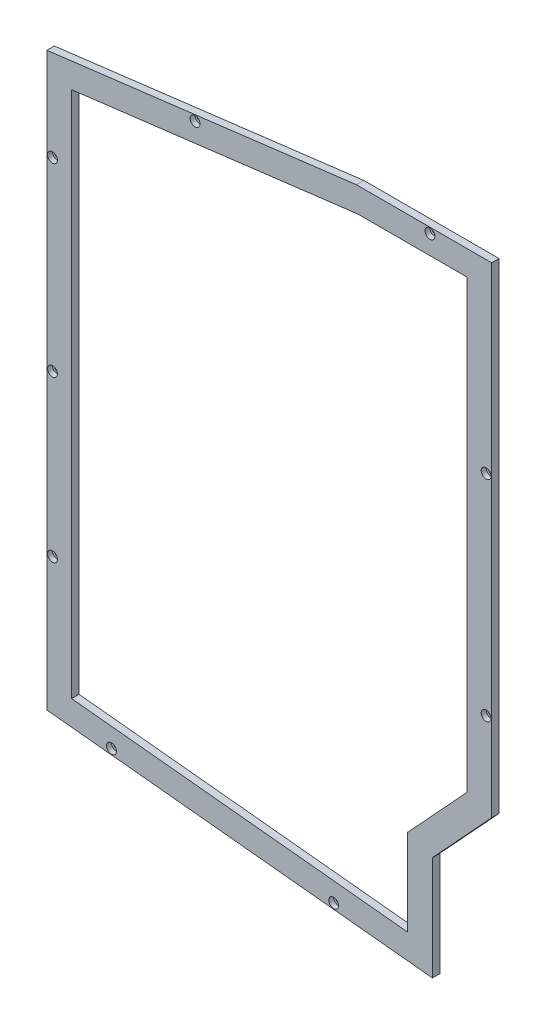
from build123d import *

# Parameters (mm, degrees)
BOSS_EXTRU_1_DEPTH                              = 6
BOSS_EXTRU_2_DEPTH                              = 6
CHAMBRAGE_POUR_VIS_T_TE_CYLINDRIQUE_D           = 4.3
CHAMBRAGE_POUR_VIS_T_TE_CYLINDRIQUE_DEPTH       = 14
CHAMBRAGE_POUR_VIS_T_TE_CYLINDRIQUE_CBORE_D     = 8
CHAMBRAGE_POUR_VIS_T_TE_CYLINDRIQUE_CBORE_DEPTH = 4
CHAMBRAGE_POUR_VIS_T_TE_CYLINDRIQUE_TIP         = 1.291850331


with BuildPart() as part:
    # Esquisse1 → Boss.-Extru.1 (new body)
    with BuildSketch(Plane.XY):
        Polygon((-377.3, 239.035929653), (-377.3, 20.870792038), (-65, -10.964070347), (-65, 73.48114549), (-17, 125.48114549), (-17, 225.48114549), (-37, 239.035929653), (-37, 133.300822179), (-85, 81.300822179), (-85, 11.178308202), (-357.3, 38.93569862), (-357.3, 225.48114549), align=None)
    extrude(amount=BOSS_EXTRU_1_DEPTH)

    # Esquisse3 → Boss.-Extru.2 (add)
    with BuildSketch(Plane.XY):
        Polygon((-17, 225.48114549), (-17, 514.843253), (-126.55504147, 514.843253), (-377.3, 483.797653512), (-377.3, 239.035929653), (-357.3, 225.48114549), (-357.3, 466.12120793), (-125.321615981, 494.843253), (-37, 494.843253), (-37, 239.035929653), align=None)
    extrude(amount=BOSS_EXTRU_2_DEPTH)

    # Chambrage pour vis à tête cylindrique à 6 pans creux (ou vis CHC) M41
    with Locations(Plane.XY.offset(6)):
        with Locations((-145, 1.714193165), (-325, 20.062817018), (-372.8, 130.870792038), (-372.8, 260.870792038), (-372.8, 410.870792038), (-257.3, 494.120907239), (-67, 510.343253), (-21.5, 194.843253), (-21.5, 364.843253)):
            CounterBoreHole(CHAMBRAGE_POUR_VIS_T_TE_CYLINDRIQUE_D / 2, CHAMBRAGE_POUR_VIS_T_TE_CYLINDRIQUE_CBORE_D / 2, CHAMBRAGE_POUR_VIS_T_TE_CYLINDRIQUE_CBORE_DEPTH, depth=CHAMBRAGE_POUR_VIS_T_TE_CYLINDRIQUE_DEPTH)
            with Locations((0, 0, -(CHAMBRAGE_POUR_VIS_T_TE_CYLINDRIQUE_DEPTH + CHAMBRAGE_POUR_VIS_T_TE_CYLINDRIQUE_TIP / 2))):  # 118° drill point
                Cone(0, CHAMBRAGE_POUR_VIS_T_TE_CYLINDRIQUE_D / 2, CHAMBRAGE_POUR_VIS_T_TE_CYLINDRIQUE_TIP, mode=Mode.SUBTRACT)


solid = part.part
